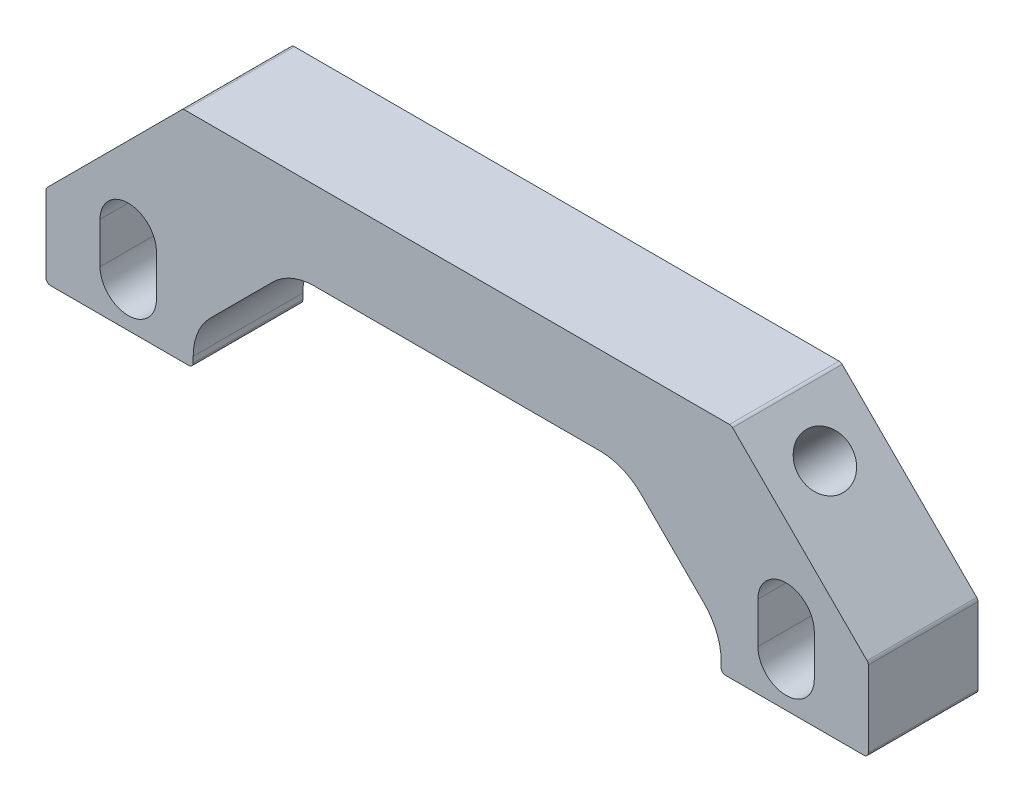
from build123d import *

# Parameters (mm, degrees)
BOSS_EXTRUDE1_DEPTH             = 6.35
CUT_EXTRUDE1_DEPTH              = 56.448991199
CUT_EXTRUDE2_DEPTH              = 56.448991199
FILLET1_R                       = 6.858
F_6_0MM_CLEARANCE_DOWEL_HOLE1_D = 6
FILLET2_R                       = 0.508


with BuildPart() as part:
    # Sketch1 → Boss-Extrude1 (new, symmetric)
    with BuildSketch(Plane.XY):
        Polygon((-47.625, 0), (47.625, 0), (47.625, 9.525), (31.75, 25.4), (-31.75, 25.4), (-47.625, 9.525), align=None)
    extrude(amount=BOSS_EXTRUDE1_DEPTH, both=True)

    # Sketch2 → Cut-Extrude1 (cut, through all)
    with BuildSketch(Plane.XY.offset(6.35)):
        with BuildLine():
            Line((-34.8361, 9.525), (-34.8361, 4.7625))
            ThreePointArc((-34.8361, 4.7625), (-38.1, 1.4986), (-41.3639, 4.7625))
            Line((-41.3639, 4.7625), (-41.3639, 9.525))
            ThreePointArc((-41.3639, 9.525), (-38.1, 12.7889), (-34.8361, 9.525))
        make_face()
        with BuildLine():
            Line((41.3639, 9.525), (41.3639, 4.7625))
            ThreePointArc((41.3639, 4.7625), (38.1, 1.4986), (34.8361, 4.7625))
            Line((34.8361, 4.7625), (34.8361, 9.525))
            ThreePointArc((34.8361, 9.525), (38.1, 12.7889), (41.3639, 9.525))
        make_face()
    extrude(amount=-CUT_EXTRUDE1_DEPTH, mode=Mode.SUBTRACT)

    # Sketch3 → Cut-Extrude2 (cut, through all)
    with BuildSketch(Plane.XY.offset(6.35)):
        Polygon((-30.574434976, 4.018858704), (-19.349114825, 15.244178855), (19.349114825, 15.244178855), (30.574434976, 4.018858704), (30.574434976, 0), (-30.574434976, 0), align=None)
    extrude(amount=-CUT_EXTRUDE2_DEPTH, mode=Mode.SUBTRACT)

    # Fillet1
    fillet1_edges = [part.edges().sort_by_distance(p)[0] for p in [
        (-19.349114825, 15.244178855, 0),
        (19.349114825, 15.244178855, 0),
        (30.574434976, 4.018858704, 0),
        (-30.574434976, 4.018858704, 0),
    ]]
    fillet(fillet1_edges, radius=FILLET1_R)

    # Ø6.0mm Clearance Dowel Hole1 (through all)
    with Locations(Plane(origin=(-17.29664684, 17.29664684, 0), x_dir=(-0.7071067811865511, -0.7071067811865439, 0), z_dir=(0.7071067811865439, -0.7071067811865511, 0))):
        with Locations((10.840128061, 0)):
            f_6_0mm_clearance_dowel_hole1 = Hole(F_6_0MM_CLEARANCE_DOWEL_HOLE1_D / 2)

    # Mirror2: Ø6.0mm Clearance Dowel Hole1 across plane
    add(f_6_0mm_clearance_dowel_hole1.mirror(Plane(origin=(0, 0, 0), x_dir=(0, 0, 1), z_dir=(1, 0, 0))), mode=Mode.SUBTRACT)

    # Fillet2
    fillet2_edges = [part.edges().sort_by_distance(p)[0] for p in [
        (-47.625, 9.525, 0),
        (-31.75, 25.4, 0),
        (31.75, 25.4, 0),
        (47.625, 9.525, 0),
        (47.625, 0, 0),
        (-47.625, 0, 0),
        (30.574434976, 0, 0),
        (-30.574434976, 0, 0),
    ]]
    fillet(fillet2_edges, radius=FILLET2_R)


solid = part.part
